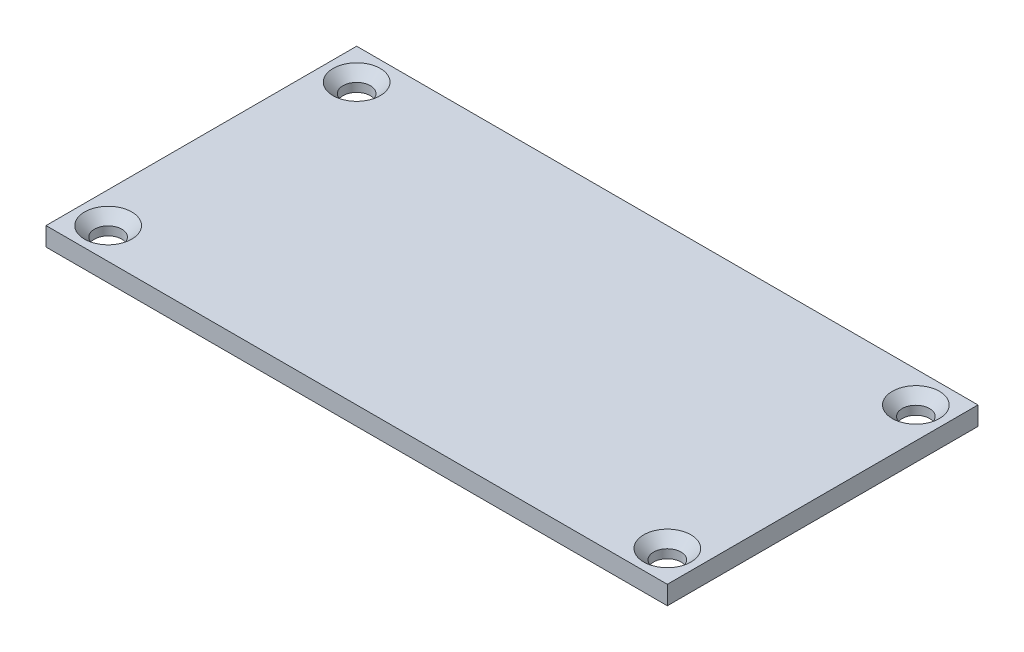
from build123d import *

# Parameters (mm, degrees)
SKETCH_1_W                  = 50
SKETCH_1_H                  = 25
EXTRUDE_1_DEPTH             = 1.5
PATTERN_LINEAR_2_COUNT      = 2
PATTERN_LINEAR_2_PITCH      = 45
PATTERN_LINEAR_2_COUNT_DIR2 = 2
PATTERN_LINEAR_2_PITCH_DIR2 = 20


with BuildPart() as part:
    # 草图1 → 凸台-拉伸1 (new body)
    with BuildSketch(Plane(origin=(0, 0, 0), x_dir=(1, 0, 0), z_dir=(0, 1, 0))):
        with Locations((25, 12.5)):
            Rectangle(SKETCH_1_W, SKETCH_1_H)
    extrude(amount=EXTRUDE_1_DEPTH)

    # 草图3 → M2 平头机械螺钉的锥形沉头孔1 (revolve, cut)
    with BuildSketch(Plane(origin=(2.5, 1.5, -22.5), x_dir=(0, 0, 1), z_dir=(1, 0, 0))):
        Polygon((0, 0), (0, 1.5), (1.1, 1.5), (1.1, 0.8), (1.9, 0), align=None)
    hole_wizard_m2_1 = revolve(axis=Axis((2.5, 7.85, -22.5), (0, -1, 0)), mode=Mode.SUBTRACT)

    # 阵列(线性)2: Hole Wizard M2 _1 2 × 2
    with Locations(*[(i * PATTERN_LINEAR_2_PITCH, 0, j * PATTERN_LINEAR_2_PITCH_DIR2) for i in range(PATTERN_LINEAR_2_COUNT) for j in range(PATTERN_LINEAR_2_COUNT_DIR2) if (i, j) != (0, 0)]):
        add(hole_wizard_m2_1, mode=Mode.SUBTRACT)


solid = part.part
